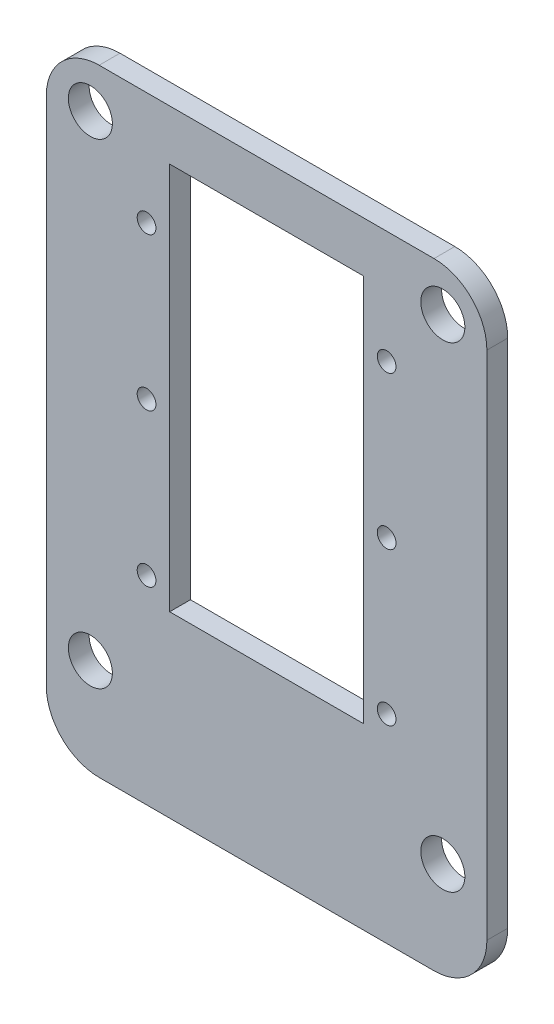
from build123d import *

# Parameters (mm, degrees)
BOSS_EXTRUDE1_DEPTH = 3
SKETCH2_R           = 1.35
SKETCH2_R_2         = 1.385
CUT_EXTRUDE1_DEPTH  = 37.692131309
SKETCH3_W           = 63.5
SKETCH3_H           = 88.9
SKETCH3_W_2         = 38.321076004
SKETCH3_H_2         = 47.237540142
BOSS_EXTRUDE2_DEPTH = 3
SKETCH5_W           = 27.94
SKETCH5_H           = 55.88
CUT_EXTRUDE3_DEPTH  = 60.892131157
SKETCH6_R           = 3.175
CUT_EXTRUDE4_DEPTH  = 60.892131157
FILLET2_R           = 7.62


with BuildPart() as part:
    # Sketch1 → Boss-Extrude1 (new body)
    with BuildSketch(Plane.XY):
        with BuildLine():
            Line((-19.69889026, 23.2987845), (-14.850045261, 29.75147823))
            ThreePointArc((-14.850045261, 29.75147823), (-14.144755454, 30.339267512), (-13.251155001, 30.55))
            Line((-13.251155001, 30.55), (13.251155001, 30.55))
            ThreePointArc((13.251155001, 30.55), (14.144755454, 30.339267512), (14.850045261, 29.75147823))
            Line((14.850045261, 29.75147823), (19.69889026, 23.2987845))
            ThreePointArc((19.69889026, 23.2987845), (19.997074131, 22.730638521), (20.1, 22.09730627))
            Line((20.1, 22.09730627), (20.1, -22.09730627))
            ThreePointArc((20.1, -22.09730627), (19.997074131, -22.730638521), (19.69889026, -23.2987845))
            Line((19.69889026, -23.2987845), (14.850045261, -29.75147823))
            ThreePointArc((14.850045261, -29.75147823), (14.144755454, -30.339267512), (13.251155001, -30.55))
            Line((13.251155001, -30.55), (-13.251155001, -30.55))
            ThreePointArc((-13.251155001, -30.55), (-14.144755454, -30.339267512), (-14.850045261, -29.75147823))
            Line((-14.850045261, -29.75147823), (-19.69889026, -23.2987845))
            ThreePointArc((-19.69889026, -23.2987845), (-19.997074131, -22.730638521), (-20.1, -22.09730627))
            Line((-20.1, -22.09730627), (-20.1, 22.09730627))
            ThreePointArc((-20.1, 22.09730627), (-19.997074131, 22.730638521), (-19.69889026, 23.2987845))
        make_face()
    extrude(amount=-BOSS_EXTRUDE1_DEPTH)

    # Sketch2 → Cut-Extrude1 (cut, through all)
    with BuildSketch(Plane(origin=(0, 0, -3), x_dir=(-1, 0, 0), z_dir=(0, 0, -1))):
        with Locations((17.3, 21.9487845)):
            Circle(SKETCH2_R)
        with Locations((17.3, -0.0512155)):
            Circle(SKETCH2_R)
        with Locations((17.3, -22.0512155)):
            Circle(SKETCH2_R)
        with Locations((11, -27.75)):
            Circle(SKETCH2_R_2)
        with Locations(Location((-11, -27.75, 0), (0, 0, 180))):
            Circle(SKETCH2_R_2)
        with Locations(Location((-17.3, -22.0512155, 0), (0, 0, 180))):
            Circle(SKETCH2_R)
        with Locations(Location((-17.3, -0.0512155, 0), (0, 0, 180))):
            Circle(SKETCH2_R)
        with Locations(Location((-17.3, 21.9487845, 0), (0, 0, 180))):
            Circle(SKETCH2_R)
    extrude(amount=-CUT_EXTRUDE1_DEPTH, mode=Mode.SUBTRACT)

    # Sketch3 → Boss-Extrude2 (add)
    with BuildSketch(Plane(origin=(0, 0, -3), x_dir=(-1, 0, 0), z_dir=(0, 0, -1))):
        with Locations((0, -6.2452155)):
            Rectangle(SKETCH3_W, SKETCH3_H)
        Rectangle(SKETCH3_W_2, SKETCH3_H_2, mode=Mode.SUBTRACT)
    extrude(amount=-BOSS_EXTRUDE2_DEPTH)

    # Sketch5 → Cut-Extrude3 (cut, through all)
    with BuildSketch(Plane.XY):
        with Locations((0, 3.0087845)):
            Rectangle(SKETCH5_W, SKETCH5_H)
    extrude(amount=-CUT_EXTRUDE3_DEPTH, mode=Mode.SUBTRACT)

    # Sketch6 → Cut-Extrude4 (cut, through all)
    with BuildSketch(Plane(origin=(0, 0, -3), x_dir=(-1, 0, 0), z_dir=(0, 0, -1))):
        with Locations((25.4, 31.8547845)):
            Circle(SKETCH6_R)
        with Locations((-25.4, 31.8547845)):
            Circle(SKETCH6_R)
        with Locations((-25.4, -36.7252155)):
            Circle(SKETCH6_R)
        with Locations((25.4, -36.7252155)):
            Circle(SKETCH6_R)
    extrude(amount=-CUT_EXTRUDE4_DEPTH, mode=Mode.SUBTRACT)

    # Fillet2
    fillet2_edges = [part.edges().sort_by_distance(p)[0] for p in [
        (-31.75, 38.2047845, -1.5),
        (-31.75, -50.6952155, -1.5),
        (31.75, -50.6952155, -1.5),
        (31.75, 38.2047845, -1.5),
    ]]
    fillet(fillet2_edges, radius=FILLET2_R)


solid = part.part
